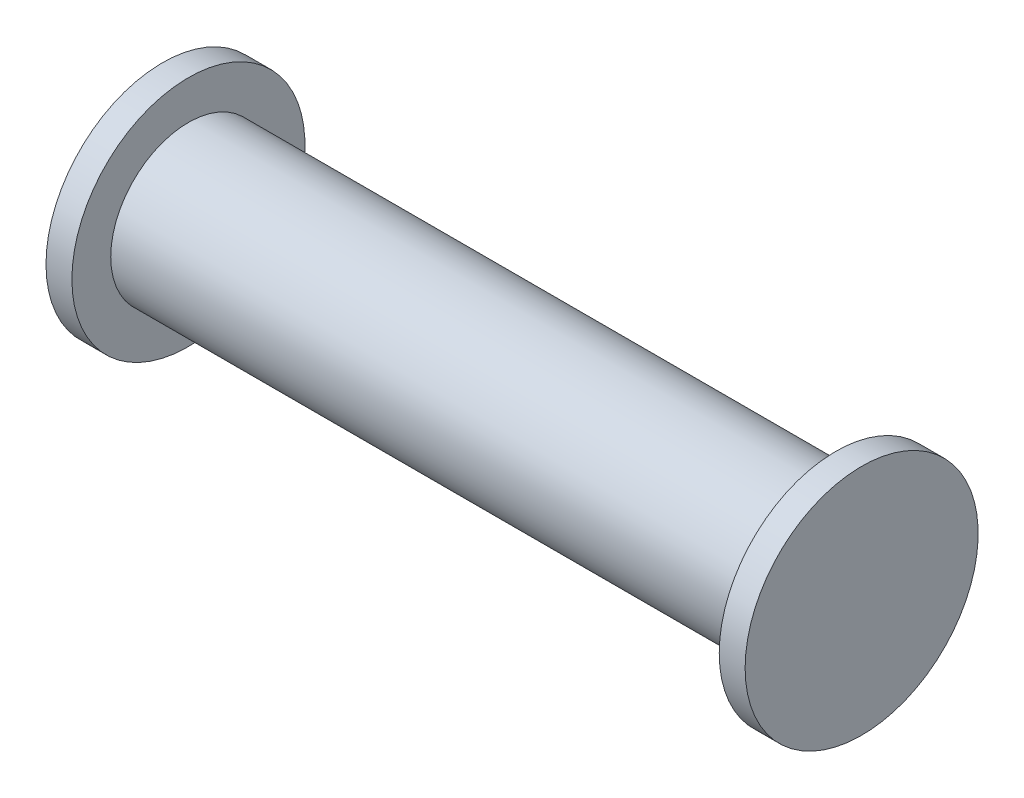
from build123d import *

# Parameters (mm, degrees)
SKETCH1_W   = 42.8625
SKETCH1_H   = 4.7625
SKETCH1_W_2 = 1.5875
SKETCH1_H_2 = 2.38125


with BuildPart() as part:
    # Sketch1 → Revolve1 (revolve)
    with BuildSketch(Plane.XY, mode=Mode.PRIVATE) as revolve1_sk:
        with Locations((21.43125, 2.38125)):
            Rectangle(SKETCH1_W, SKETCH1_H)
        with Locations((0.79375, 5.953125)):
            Rectangle(SKETCH1_W_2, SKETCH1_H_2)
        with Locations((42.06875, 5.953125)):
            Rectangle(SKETCH1_W_2, SKETCH1_H_2)
    revolve(revolve1_sk.sketch.rotate(Axis((0, 0, 0), (1, 0, 0)), 90), axis=Axis((0, 0, 0), (1, 0, 0)))


solid = part.part
